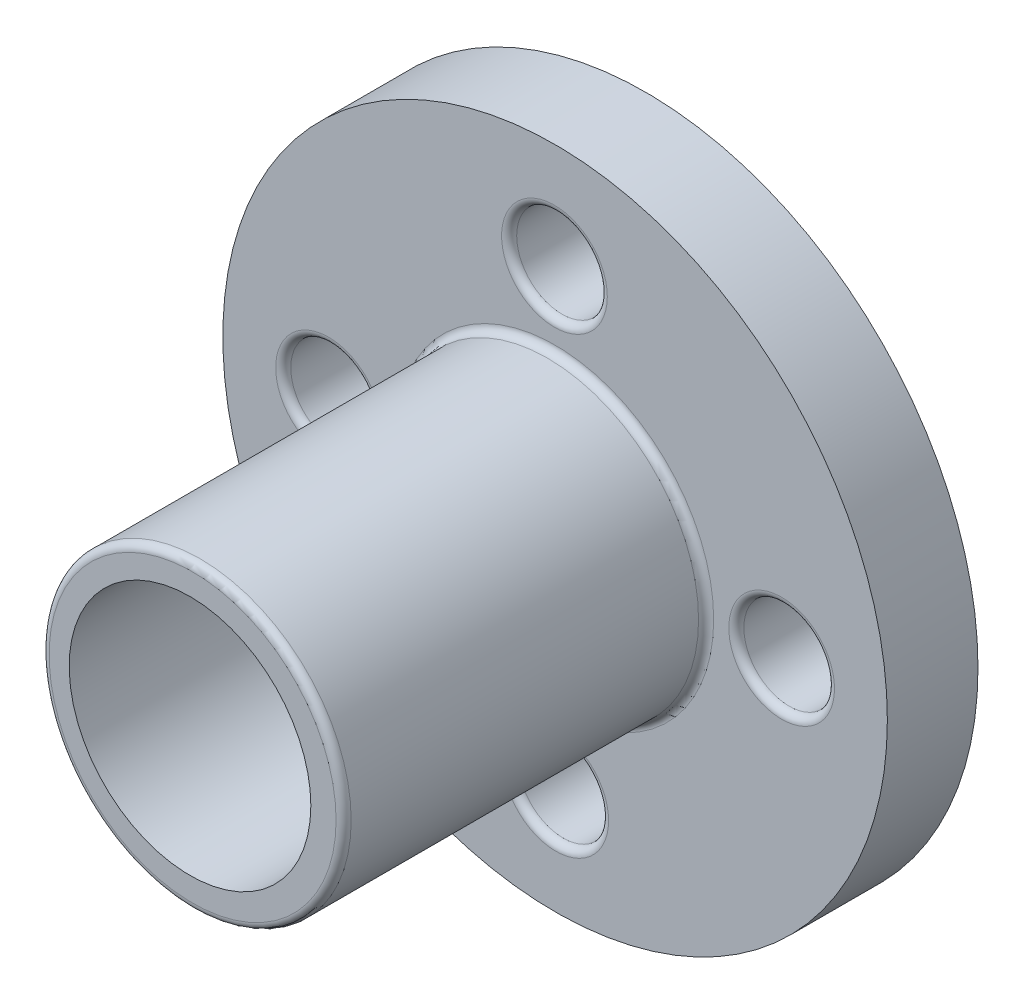
from build123d import *

# Parameters (mm, degrees)
ESQUISSE1_R             = 11
BOSS_EXTRU_1_DEPTH      = 3
ESQUISSE2_R             = 5
ESQUISSE2_R_2           = 4
BOSS_EXTRU_2_DEPTH      = 12
ESQUISSE3_R             = 4
ENL_V_MAT_EXTRU_1_DEPTH = 3
ESQUISSE4_R             = 1.5
ENL_V_MAT_EXTRU_2_DEPTH = 12
CONG_1_R                = 0.25
CONG_2_R                = 0.25
CONG_3_R                = 0.25


with BuildPart() as part:
    # Esquisse1 → Boss.-Extru.1 (new body)
    with BuildSketch(Plane.XY):
        Circle(ESQUISSE1_R)
    extrude(amount=BOSS_EXTRU_1_DEPTH)

    # Esquisse2 → Boss.-Extru.2 (add)
    with BuildSketch(Plane.XY.offset(3)):
        Circle(ESQUISSE2_R)
        with Locations((-0.085794689, 0)):
            Circle(ESQUISSE2_R_2, mode=Mode.SUBTRACT)
    extrude(amount=BOSS_EXTRU_2_DEPTH)

    # Esquisse3 → Enlèv. mat.-Extru.1 (cut)
    with BuildSketch(Plane(origin=(0, 0, 0), x_dir=(-1, 0, 0), z_dir=(0, 0, -1))):
        Circle(ESQUISSE3_R)
    extrude(amount=-ENL_V_MAT_EXTRU_1_DEPTH, mode=Mode.SUBTRACT)

    # Esquisse4 → Enlèv. mat.-Extru.2 (cut)
    with BuildSketch(Plane(origin=(0, 0, 0), x_dir=(-1, 0, 0), z_dir=(0, 0, -1))):
        with Locations((0.021448672, 7.499884985)):
            Circle(ESQUISSE4_R)
        with Locations((7.499884985, -0.021448672)):
            Circle(ESQUISSE4_R)
        with Locations((-0.021448672, -7.499884985)):
            Circle(ESQUISSE4_R)
        with Locations((-7.499884985, 0.021448672)):
            Circle(ESQUISSE4_R)
    extrude(amount=-ENL_V_MAT_EXTRU_2_DEPTH, mode=Mode.SUBTRACT)

    # Congé1
    cong_1_edges = [part.edges().sort_by_distance(p)[0] for p in [
        (1.478551328, 7.499884985, 3),
        (-5.999884985, -0.021448672, 3),
        (1.521448672, -7.499884985, 3),
        (8.999884985, 0.021448672, 3),
    ]]
    fillet(cong_1_edges, radius=CONG_1_R)

    # Congé2
    cong_2_edges = [part.edges().sort_by_distance(p)[0] for p in [
        (-5, 0, 15),
    ]]
    fillet(cong_2_edges, radius=CONG_2_R)

    # Congé3
    cong_3_edges = [part.edges().sort_by_distance(p)[0] for p in [
        (-5, 0, 3),
    ]]
    fillet(cong_3_edges, radius=CONG_3_R)


solid = part.part
